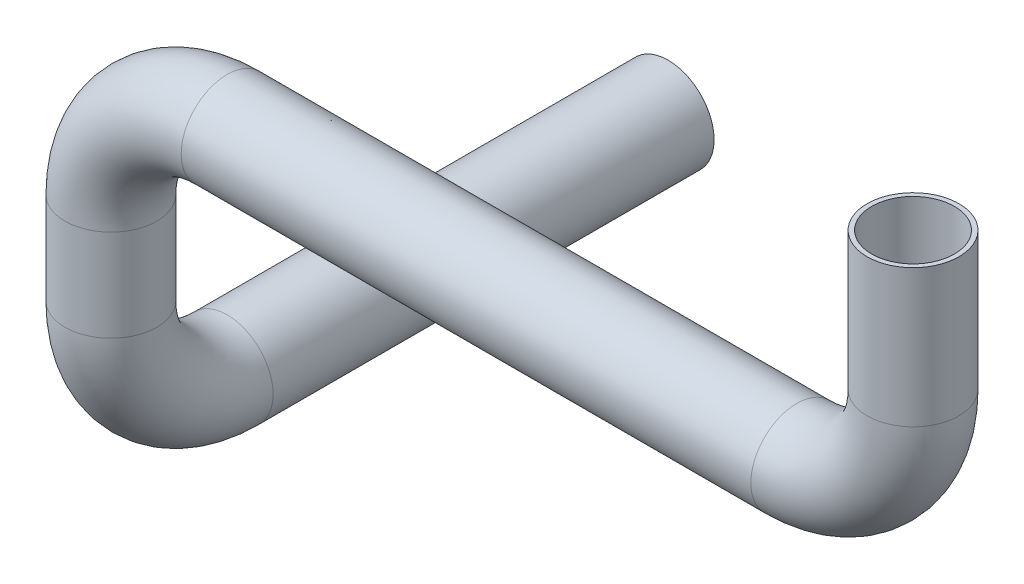
from build123d import *

# Parameters (mm, degrees)
SKETCH1_R = 5
SKETCH3_R = 5
SHELL1_T  = -0.5


with BuildPart() as part:
    # Sweep1: sweep along a path in Sketch2
    with BuildLine(Plane.XY) as sweep1_path:
        Line((0, 0), (0, 10))
        ThreePointArc((0, 10), (3.705099218, 18.944900782), (12.65, 22.65))
        Line((12.65, 22.65), (74.65, 22.65))
        ThreePointArc((74.65, 22.65), (83.594900782, 26.355099218), (87.3, 35.3))
        Line((87.3, 35.3), (87.3, 50.3))
    # Sketch1 → Sweep1 (sweep)
    with BuildSketch(Plane(origin=(0, 0, 0), x_dir=(1, 0, 0), z_dir=(0, 1, 0))):
        Circle(SKETCH1_R)
    sweep(path=sweep1_path.line)

    # Sweep2: sweep along a path in Sketch5
    with BuildLine(Plane(origin=(0, 0, 0), x_dir=(0, 0, -1), z_dir=(1, 0, 0))) as sweep2_path:
        Line((60.65, -12.65), (12.65, -12.65))
        ThreePointArc((12.65, -12.65), (3.705099218, -8.944900782), (0, 0))
    # Sketch3 → Sweep2 (sweep)
    with BuildSketch(Plane.XZ):
        Circle(SKETCH3_R)
    sweep(path=sweep2_path.line)

    # Shell1
    shell1_openings = [part.faces().sort_by_distance(p)[0] for p in [
        (0, -12.65, -60.65),
        (87.3, 50.3, 0),
    ]]
    offset(amount=SHELL1_T, openings=shell1_openings, kind=Kind.INTERSECTION)


solid = part.part
